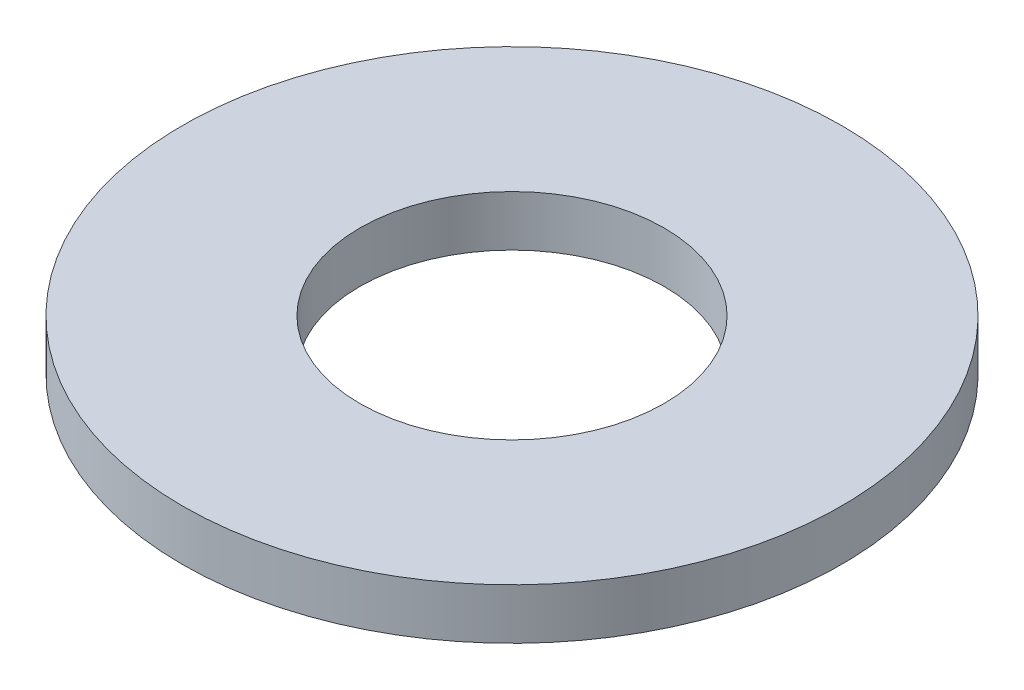
from build123d import *

# Parameters (mm, degrees)
SKETCH_1_R      = 6.5
SKETCH_1_R_2    = 3
EXTRUDE_1_DEPTH = 1


with BuildPart() as part:
    # 草图1 → 凸台-拉伸1 (new body)
    with BuildSketch(Plane(origin=(0, 0, 0), x_dir=(1, 0, 0), z_dir=(0, 1, 0))):
        with Locations(Location((0, 0, 0), (0, 0, 270))):
            Circle(SKETCH_1_R)
        with Locations(Location((0, 0, 0), (0, 0, 270))):
            Circle(SKETCH_1_R_2, mode=Mode.SUBTRACT)
    extrude(amount=EXTRUDE_1_DEPTH)


solid = part.part
